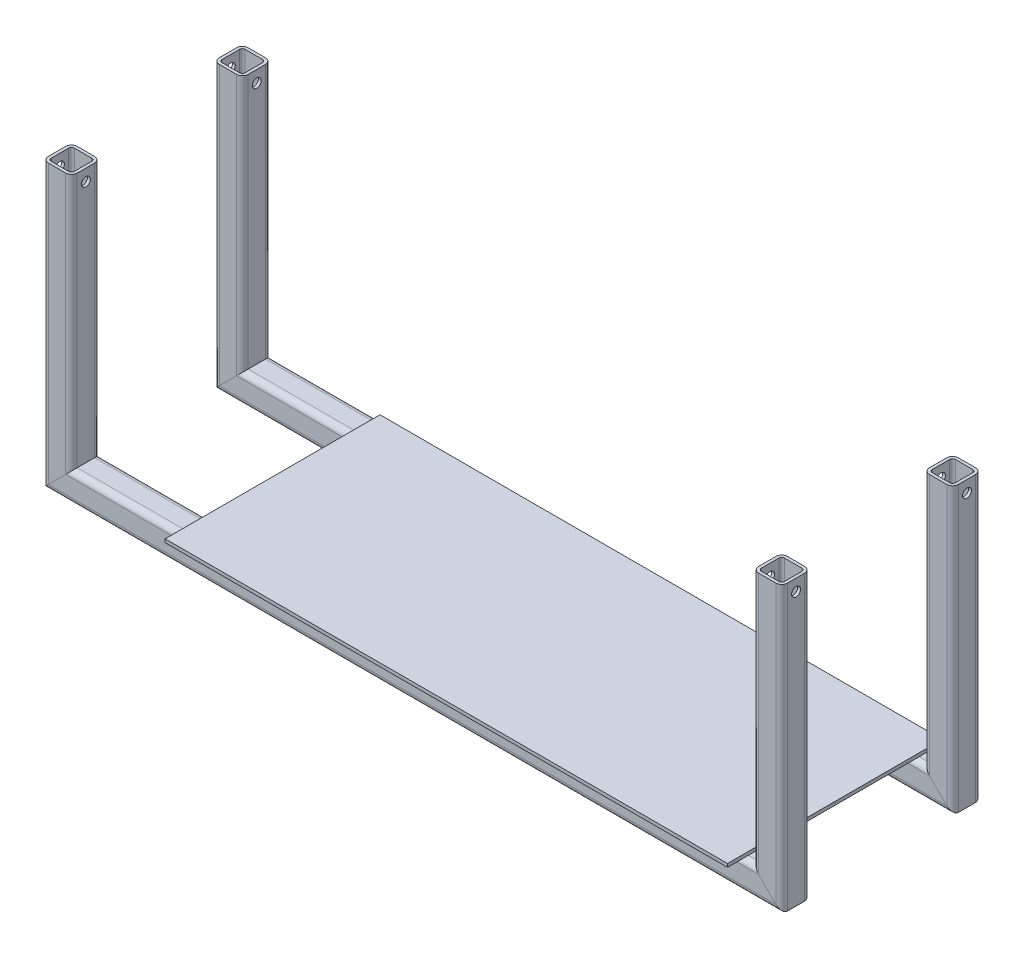
from build123d import *

# Parameters (mm, degrees)
SQUARE_TUBE_20_X_20_X_2_1_DEPTH        = 202.142135624
SQUARE_TUBE_20_X_20_X_2_1_2_DEPTH      = 522.784271247
SQUARE_TUBE_20_X_20_X_2_1_3_DEPTH      = 187
SQUARE_TUBE_20_X_20_X_2_1_3_DEPTH_BACK = 15.142135624
SQUARE_TUBE_20_X_20_X_2_1_4_DEPTH      = 202.142135624
SQUARE_TUBE_20_X_20_X_2_1_5_DEPTH      = 522.784271247
SQUARE_TUBE_20_X_20_X_2_1_6_DEPTH      = 202.142135624
SKETCH2_W                              = 390
SKETCH2_H                              = 149
BOSS_EXTRUDE1_DEPTH                    = 2.3
SKETCH3_R                              = 3.1
CUT_EXTRUDE1_DEPTH                     = 10000
SKETCH4_R                              = 3.1
CUT_EXTRUDE2_DEPTH                     = 10000


with BuildPart() as part:
    # Sketch1 on segment 1 (carried to segment 1) → Square tube 20 X 20 X 2(1) (new body)
    with BuildSketch(Plane(origin=(246.25, 187, 59.25), x_dir=(-1, 0, 0), z_dir=(0, -1, 0))):
        with BuildLine():
            Line((-6, -10), (6, -10))
            ThreePointArc((6, -10), (8.828427125, -8.828427125), (10, -6))
            Line((10, -6), (10, 6))
            ThreePointArc((10, 6), (8.828427125, 8.828427125), (6, 10))
            Line((6, 10), (-6, 10))
            ThreePointArc((-6, 10), (-8.828427125, 8.828427125), (-10, 6))
            Line((-10, 6), (-10, -6))
            ThreePointArc((-10, -6), (-8.828427125, -8.828427125), (-6, -10))
        make_face()
        with BuildLine():
            Line((-6, -8), (6, -8))
            ThreePointArc((6, -8), (7.414213562, -7.414213562), (8, -6))
            Line((8, -6), (8, 6))
            ThreePointArc((8, 6), (7.414213562, 7.414213562), (6, 8))
            Line((6, 8), (-6, 8))
            ThreePointArc((-6, 8), (-7.414213562, 7.414213562), (-8, 6))
            Line((-8, 6), (-8, -6))
            ThreePointArc((-8, -6), (-7.414213562, -7.414213562), (-6, -8))
        make_face(mode=Mode.SUBTRACT)
    extrude(amount=SQUARE_TUBE_20_X_20_X_2_1_DEPTH)

    # Square tube 20 X 20 X 2(1) mitre 1
    split(bisect_by=Plane(origin=(246.25, 0, 59.25), x_dir=(-0.707106781, 0.707106781, 0), z_dir=(0.707106781, 0.707106781, 0)), keep=Keep.TOP)


with BuildPart() as body_2:
    # Sketch1 on segment 2 (carried to segment 2) → Square tube 20 X 20 X 2_1 2 (new body)
    with BuildSketch(Plane(origin=(261.392135624, 0, 59.25), x_dir=(0, 1, 0), z_dir=(-1, 0, 0))):
        with BuildLine():
            Line((-6, -10), (6, -10))
            ThreePointArc((6, -10), (8.828427125, -8.828427125), (10, -6))
            Line((10, -6), (10, 6))
            ThreePointArc((10, 6), (8.828427125, 8.828427125), (6, 10))
            Line((6, 10), (-6, 10))
            ThreePointArc((-6, 10), (-8.828427125, 8.828427125), (-10, 6))
            Line((-10, 6), (-10, -6))
            ThreePointArc((-10, -6), (-8.828427125, -8.828427125), (-6, -10))
        make_face()
        with BuildLine():
            Line((-6, -8), (6, -8))
            ThreePointArc((6, -8), (7.414213562, -7.414213562), (8, -6))
            Line((8, -6), (8, 6))
            ThreePointArc((8, 6), (7.414213562, 7.414213562), (6, 8))
            Line((6, 8), (-6, 8))
            ThreePointArc((-6, 8), (-7.414213562, 7.414213562), (-8, 6))
            Line((-8, 6), (-8, -6))
            ThreePointArc((-8, -6), (-7.414213562, -7.414213562), (-6, -8))
        make_face(mode=Mode.SUBTRACT)
    extrude(amount=SQUARE_TUBE_20_X_20_X_2_1_2_DEPTH)

    # Square tube 20 X 20 X 2_1 2 mitre 1
    split(bisect_by=Plane(origin=(-246.25, 0, 59.25), x_dir=(0.707106781, 0.707106781, 0), z_dir=(0.707106781, -0.707106781, 0)), keep=Keep.TOP)

    # Square tube 20 X 20 X 2_1 2 mitre 2
    split(bisect_by=Plane(origin=(246.25, 0, 59.25), x_dir=(0.707106781, -0.707106781, 0), z_dir=(-0.707106781, -0.707106781, 0)), keep=Keep.TOP)


with BuildPart() as body_3:
    # Sketch1 → Square tube 20 X 20 X 2_1 3 (new, two sides: drawn at the far end of the back side and taken through both)
    with BuildSketch(Plane(origin=(-246.25, 0, 59.25), x_dir=(1, 0, 0), z_dir=(0, 1, 0)).offset(-SQUARE_TUBE_20_X_20_X_2_1_3_DEPTH_BACK)):
        with BuildLine():
            Line((-6, -10), (6, -10))
            ThreePointArc((6, -10), (8.828427125, -8.828427125), (10, -6))
            Line((10, -6), (10, 6))
            ThreePointArc((10, 6), (8.828427125, 8.828427125), (6, 10))
            Line((6, 10), (-6, 10))
            ThreePointArc((-6, 10), (-8.828427125, 8.828427125), (-10, 6))
            Line((-10, 6), (-10, -6))
            ThreePointArc((-10, -6), (-8.828427125, -8.828427125), (-6, -10))
        make_face()
        with BuildLine():
            Line((-6, -8), (6, -8))
            ThreePointArc((6, -8), (7.414213562, -7.414213562), (8, -6))
            Line((8, -6), (8, 6))
            ThreePointArc((8, 6), (7.414213562, 7.414213562), (6, 8))
            Line((6, 8), (-6, 8))
            ThreePointArc((-6, 8), (-7.414213562, 7.414213562), (-8, 6))
            Line((-8, 6), (-8, -6))
            ThreePointArc((-8, -6), (-7.414213562, -7.414213562), (-6, -8))
        make_face(mode=Mode.SUBTRACT)
    extrude(amount=SQUARE_TUBE_20_X_20_X_2_1_3_DEPTH + SQUARE_TUBE_20_X_20_X_2_1_3_DEPTH_BACK)

    # Square tube 20 X 20 X 2_1 3 mitre 1
    split(bisect_by=Plane(origin=(-246.25, 0, 59.25), x_dir=(-0.707106781, -0.707106781, 0), z_dir=(-0.707106781, 0.707106781, 0)), keep=Keep.TOP)


with BuildPart() as body_4:
    # Sketch1 on segment 4 (carried to segment 4) → Square tube 20 X 20 X 2_1 4 (new body)
    with BuildSketch(Plane(origin=(246.25, -15.142135624, -59.25), x_dir=(1, 0, 0), z_dir=(0, 1, 0))):
        with BuildLine():
            Line((-6, -10), (6, -10))
            ThreePointArc((6, -10), (8.828427125, -8.828427125), (10, -6))
            Line((10, -6), (10, 6))
            ThreePointArc((10, 6), (8.828427125, 8.828427125), (6, 10))
            Line((6, 10), (-6, 10))
            ThreePointArc((-6, 10), (-8.828427125, 8.828427125), (-10, 6))
            Line((-10, 6), (-10, -6))
            ThreePointArc((-10, -6), (-8.828427125, -8.828427125), (-6, -10))
        make_face()
        with BuildLine():
            Line((-6, -8), (6, -8))
            ThreePointArc((6, -8), (7.414213562, -7.414213562), (8, -6))
            Line((8, -6), (8, 6))
            ThreePointArc((8, 6), (7.414213562, 7.414213562), (6, 8))
            Line((6, 8), (-6, 8))
            ThreePointArc((-6, 8), (-7.414213562, 7.414213562), (-8, 6))
            Line((-8, 6), (-8, -6))
            ThreePointArc((-8, -6), (-7.414213562, -7.414213562), (-6, -8))
        make_face(mode=Mode.SUBTRACT)
    extrude(amount=SQUARE_TUBE_20_X_20_X_2_1_4_DEPTH)

    # Square tube 20 X 20 X 2_1 4 mitre 1
    split(bisect_by=Plane(origin=(246.25, 0, -59.25), x_dir=(-0.707106781, 0.707106781, 0), z_dir=(0.707106781, 0.707106781, 0)), keep=Keep.TOP)


with BuildPart() as body_5:
    # Sketch1 on segment 5 (carried to segment 5) → Square tube 20 X 20 X 2_1 5 (new body)
    with BuildSketch(Plane(origin=(-261.392135624, 0, -59.25), x_dir=(0, -1, 0), z_dir=(1, 0, 0))):
        with BuildLine():
            Line((-6, -10), (6, -10))
            ThreePointArc((6, -10), (8.828427125, -8.828427125), (10, -6))
            Line((10, -6), (10, 6))
            ThreePointArc((10, 6), (8.828427125, 8.828427125), (6, 10))
            Line((6, 10), (-6, 10))
            ThreePointArc((-6, 10), (-8.828427125, 8.828427125), (-10, 6))
            Line((-10, 6), (-10, -6))
            ThreePointArc((-10, -6), (-8.828427125, -8.828427125), (-6, -10))
        make_face()
        with BuildLine():
            Line((-6, -8), (6, -8))
            ThreePointArc((6, -8), (7.414213562, -7.414213562), (8, -6))
            Line((8, -6), (8, 6))
            ThreePointArc((8, 6), (7.414213562, 7.414213562), (6, 8))
            Line((6, 8), (-6, 8))
            ThreePointArc((-6, 8), (-7.414213562, 7.414213562), (-8, 6))
            Line((-8, 6), (-8, -6))
            ThreePointArc((-8, -6), (-7.414213562, -7.414213562), (-6, -8))
        make_face(mode=Mode.SUBTRACT)
    extrude(amount=SQUARE_TUBE_20_X_20_X_2_1_5_DEPTH)

    # Square tube 20 X 20 X 2_1 5 mitre 1
    split(bisect_by=Plane(origin=(-246.25, 0, -59.25), x_dir=(0.707106781, 0.707106781, 0), z_dir=(0.707106781, -0.707106781, 0)), keep=Keep.TOP)

    # Square tube 20 X 20 X 2_1 5 mitre 2
    split(bisect_by=Plane(origin=(246.25, 0, -59.25), x_dir=(0.707106781, -0.707106781, 0), z_dir=(-0.707106781, -0.707106781, 0)), keep=Keep.TOP)


with BuildPart() as body_6:
    # Sketch1 on segment 6 (carried to segment 6) → Square tube 20 X 20 X 2_1 6 (new body)
    with BuildSketch(Plane(origin=(-246.25, -15.142135624, -59.25), x_dir=(1, 0, 0), z_dir=(0, 1, 0))):
        with BuildLine():
            Line((-6, -10), (6, -10))
            ThreePointArc((6, -10), (8.828427125, -8.828427125), (10, -6))
            Line((10, -6), (10, 6))
            ThreePointArc((10, 6), (8.828427125, 8.828427125), (6, 10))
            Line((6, 10), (-6, 10))
            ThreePointArc((-6, 10), (-8.828427125, 8.828427125), (-10, 6))
            Line((-10, 6), (-10, -6))
            ThreePointArc((-10, -6), (-8.828427125, -8.828427125), (-6, -10))
        make_face()
        with BuildLine():
            Line((-6, -8), (6, -8))
            ThreePointArc((6, -8), (7.414213562, -7.414213562), (8, -6))
            Line((8, -6), (8, 6))
            ThreePointArc((8, 6), (7.414213562, 7.414213562), (6, 8))
            Line((6, 8), (-6, 8))
            ThreePointArc((-6, 8), (-7.414213562, 7.414213562), (-8, 6))
            Line((-8, 6), (-8, -6))
            ThreePointArc((-8, -6), (-7.414213562, -7.414213562), (-6, -8))
        make_face(mode=Mode.SUBTRACT)
    extrude(amount=SQUARE_TUBE_20_X_20_X_2_1_6_DEPTH)

    # Square tube 20 X 20 X 2_1 6 mitre 1
    split(bisect_by=Plane(origin=(-246.25, 0, -59.25), x_dir=(-0.707106781, -0.707106781, 0), z_dir=(-0.707106781, 0.707106781, 0)), keep=Keep.TOP)


with BuildPart() as body_7:
    # Sketch2 → Boss-Extrude1 (new body)
    with BuildSketch(Plane(origin=(0, 10, 0), x_dir=(1, 0, 0), z_dir=(0, 1, 0))):
        with Locations((34.191782405, -5.25)):
            Rectangle(SKETCH2_W, SKETCH2_H)
    extrude(amount=BOSS_EXTRUDE1_DEPTH)


with BuildPart() as cut_extrude1_tool:
    # Sketch3 → Cut-Extrude1 (new body)
    with BuildSketch(Plane(origin=(0, 0, 0), x_dir=(0, 0, -1), z_dir=(1, 0, 0))):
        with Locations(Location((59.25, 178.8, 0), (0, 0, 180))):
            Circle(SKETCH3_R)
        with Locations(Location((-59.25, 178.8, 0), (0, 0, 180))):
            Circle(SKETCH3_R)
    extrude(amount=-CUT_EXTRUDE1_DEPTH)


with BuildPart() as body_3_1:
    add(body_3.part)

    # Cut-Extrude1: cut by cut_extrude1_tool
    add(cut_extrude1_tool.part, mode=Mode.SUBTRACT)


with BuildPart() as body_6_1:
    add(body_6.part)

    # Cut-Extrude1: cut by cut_extrude1_tool
    add(cut_extrude1_tool.part, mode=Mode.SUBTRACT)


with BuildPart() as cut_extrude2_tool:
    # Sketch4 → Cut-Extrude2 (new body)
    with BuildSketch(Plane(origin=(0, 0, 0), x_dir=(0, 0, -1), z_dir=(1, 0, 0))):
        with Locations((59.25, 178.8)):
            Circle(SKETCH4_R)
        with Locations((-59.25, 178.8)):
            Circle(SKETCH4_R)
    extrude(amount=CUT_EXTRUDE2_DEPTH)


with BuildPart() as part_1:
    add(part.part)

    # Cut-Extrude2: cut by cut_extrude2_tool
    add(cut_extrude2_tool.part, mode=Mode.SUBTRACT)


with BuildPart() as body_4_1:
    add(body_4.part)

    # Cut-Extrude2: cut by cut_extrude2_tool
    add(cut_extrude2_tool.part, mode=Mode.SUBTRACT)


solid = Compound([body_2.part, body_5.part, body_7.part, body_3_1.part, body_6_1.part, part_1.part, body_4_1.part])
